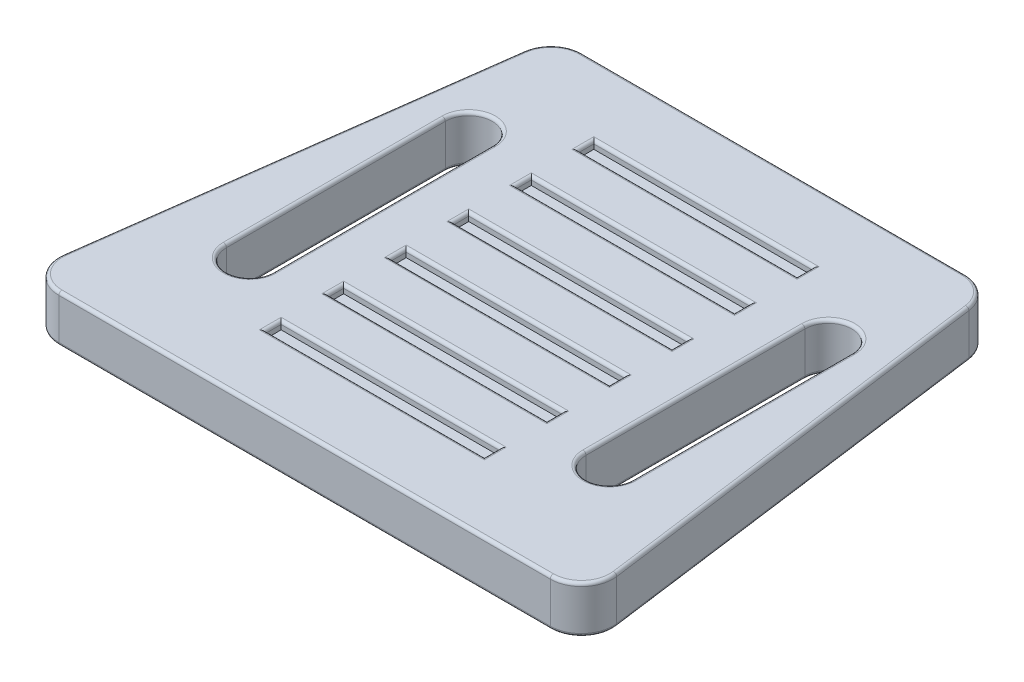
from build123d import *

# Parameters (mm, degrees)
BOSS_EXTRUDE1_DEPTH = 3
SKETCH2_W           = 14
SKETCH2_H           = 1
CUT_EXTRUDE1_DEPTH  = 0.5
FILLET1_R           = 0.2


with BuildPart() as part:
    # Sketch1 → Boss-Extrude1 (new body)
    with BuildSketch(Plane(origin=(0, 0, 0), x_dir=(1, 0, 0), z_dir=(0, 1, 0))):
        with BuildLine():
            Line((15.715633873, 0), (-15.715633873, 0))
            ThreePointArc((-15.715633873, 0), (-17.220402108, 0.682550737), (-17.698089675, 2.26432744))
            Line((-17.698089675, 2.26432744), (-14.231423008, 28.26432744))
            ThreePointArc((-14.231423008, 28.26432744), (-13.566416469, 29.504768235), (-12.248967207, 30))
            Line((-12.248967207, 30), (12.248967207, 30))
            ThreePointArc((12.248967207, 30), (13.566416469, 29.504768235), (14.231423008, 28.26432744))
            Line((14.231423008, 28.26432744), (17.698089675, 2.26432744))
            ThreePointArc((17.698089675, 2.26432744), (17.220402108, 0.682550737), (15.715633873, 0))
        make_face()
        with BuildLine():
            Line((-10, 22), (-10, 8))
            ThreePointArc((-10, 8), (-11.5, 6.5), (-13, 8))
            Line((-13, 8), (-13, 22))
            ThreePointArc((-13, 22), (-11.5, 23.5), (-10, 22))
        make_face(mode=Mode.SUBTRACT)
        with BuildLine():
            Line((10, 22), (10, 8))
            ThreePointArc((10, 8), (11.5, 6.5), (13, 8))
            Line((13, 8), (13, 22))
            ThreePointArc((13, 22), (11.5, 23.5), (10, 22))
        make_face(mode=Mode.SUBTRACT)
    extrude(amount=BOSS_EXTRUDE1_DEPTH)

    # Sketch2 → Cut-Extrude1 (cut)
    with BuildSketch(Plane(origin=(0, 3, 0), x_dir=(1, 0, 0), z_dir=(0, 1, 0))):
        with Locations((0, 5)):
            Rectangle(SKETCH2_W, SKETCH2_H)
        with Locations((0, 9)):
            Rectangle(SKETCH2_W, SKETCH2_H)
        with Locations((0, 13)):
            Rectangle(SKETCH2_W, SKETCH2_H)
        with Locations((0, 17)):
            Rectangle(SKETCH2_W, SKETCH2_H)
        with Locations((0, 21)):
            Rectangle(SKETCH2_W, SKETCH2_H)
        with Locations((0, 25)):
            Rectangle(SKETCH2_W, SKETCH2_H)
    extrude(amount=-CUT_EXTRUDE1_DEPTH, mode=Mode.SUBTRACT)

    # Fillet1
    fillet1_edges = [part.edges().sort_by_distance(p)[0] for p in [
        (17.220402108, 3, -0.682550737),
        (-7, 3, -21),
        (0, 3, -20.5),
        (7, 3, -21),
        (0, 0, 0),
        (0, 3, -21.5),
        (-17.220402108, 0, -0.682550737),
        (-7, 3, -25),
        (0, 3, -24.5),
        (7, 3, -25),
        (0, 3, -25.5),
        (15.964756341, 3, -15.26432744),
        (13.566416469, 3, -29.504768235),
        (0, 3, -30),
        (-13.566416469, 3, -29.504768235),
        (-11.5, 0, -23.5),
        (-13, 0, -15),
        (-11.5, 0, -6.5),
        (-10, 0, -15),
        (-15.964756341, 3, -15.26432744),
        (-11.5, 3, -23.5),
        (-13, 3, -15),
        (-11.5, 3, -6.5),
        (-10, 3, -15),
        (11.5, 0, -23.5),
        (10, 0, -15),
        (11.5, 0, -6.5),
        (13, 0, -15),
        (11.5, 3, -23.5),
        (10, 3, -15),
        (11.5, 3, -6.5),
        (13, 3, -15),
        (-17.220402108, 3, -0.682550737),
        (-7, 3, -5),
        (0, 3, -4.5),
        (7, 3, -5),
        (0, 3, -5.5),
        (-7, 3, -9),
        (0, 3, -8.5),
        (7, 3, -9),
        (0, 3, -9.5),
        (0, 3, 0),
        (-15.964756341, 0, -15.26432744),
        (-7, 3, -13),
        (0, 3, -12.5),
        (7, 3, -13),
        (0, 3, -13.5),
        (-13.566416469, 0, -29.504768235),
        (0, 0, -30),
        (13.566416469, 0, -29.504768235),
        (-7, 3, -17),
        (0, 3, -16.5),
        (7, 3, -17),
        (0, 3, -17.5),
        (15.964756341, 0, -15.26432744),
        (17.220402108, 0, -0.682550737),
    ]]
    fillet(fillet1_edges, radius=FILLET1_R)


solid = part.part
